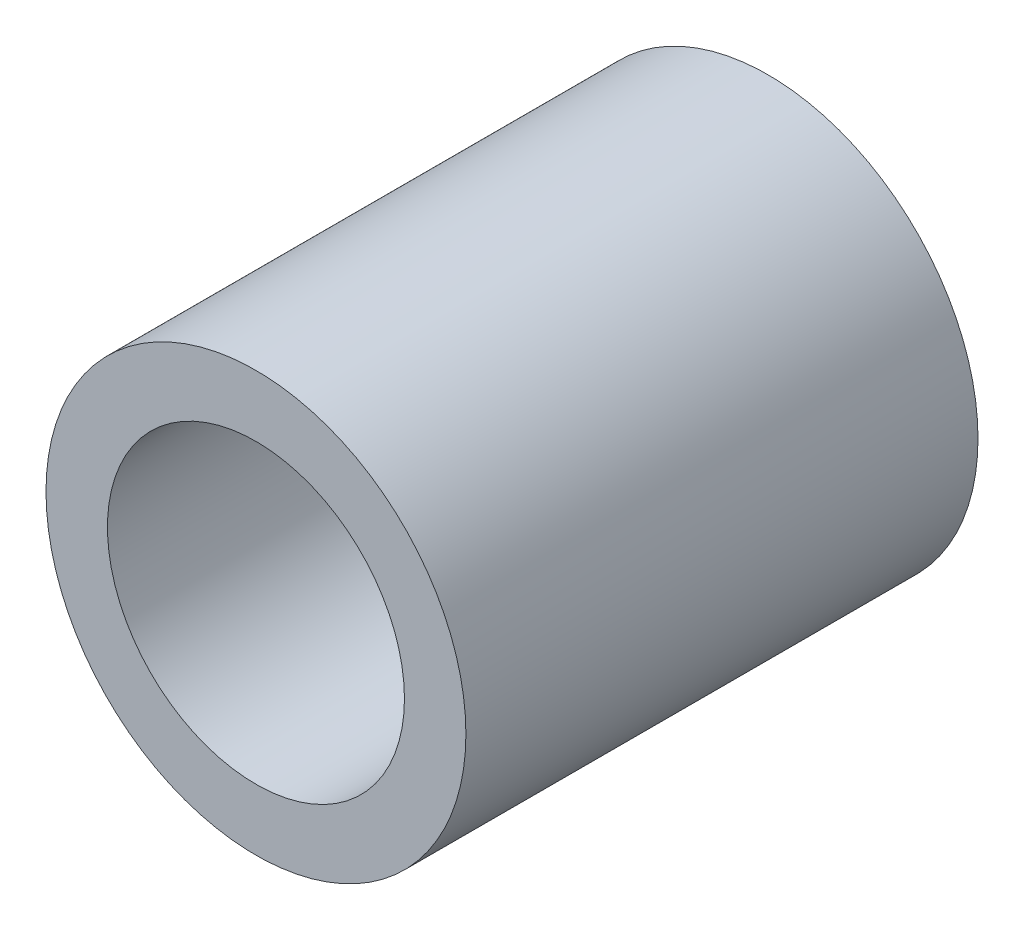
from build123d import *

# Parameters (mm, degrees)
SKETCH1_R           = 2.05
SKETCH1_R_2         = 1.45
BOSS_EXTRUDE1_DEPTH = 5


with BuildPart() as part:
    # Sketch1 → Boss-Extrude1 (new body)
    with BuildSketch(Plane.XY):
        Circle(SKETCH1_R)
        Circle(SKETCH1_R_2, mode=Mode.SUBTRACT)
    extrude(amount=BOSS_EXTRUDE1_DEPTH)


solid = part.part
